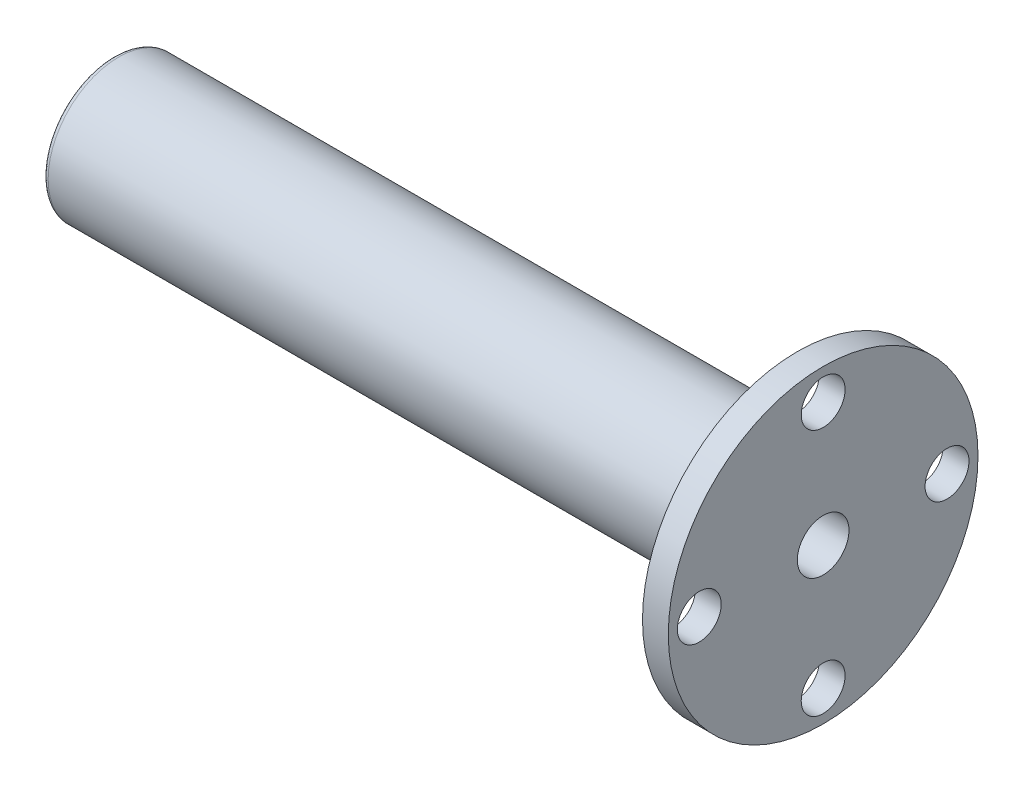
from build123d import *

# Parameters (mm, degrees)
ESQUISSE2_R                  = 8.5
ESQUISSE2_R_2                = 10
ENL_V_MAT_EXTRU_1_DEPTH      = 25
ESQUISSE3_R                  = 5
ENL_V_MAT_EXTRU_2_DEPTH      = 113.6
CONG_1_R                     = 2
ENL_V_MAT_EXTRU_3_DEPTH      = 5
ENL_V_MAT_EXTRU_3_DEPTH_BACK = 105.5
ESQUISSE4_R                  = 5


with BuildPart() as part:
    # Esquisse1 → Révolution1 (revolve)
    with BuildSketch(Plane.XY, mode=Mode.PRIVATE) as r_volution1_sk:
        Polygon((-75.054401386, 0), (199.945598614, 0), (199.945598614, 60), (189.945598614, 60), (189.945598614, 27.3), (-75.054401386, 27.3), align=None)
    revolve(r_volution1_sk.sketch.rotate(Axis((-75.054401386, 0, 0), (1, 0, 0)), 90), axis=Axis((-75.054401386, 0, 0), (1, 0, 0)))

    # Esquisse2 → Enlèv. mat.-Extru.1 (cut)
    with BuildSketch(Plane(origin=(199.945598614, 0, 0), x_dir=(0, 0, -1), z_dir=(1, 0, 0))):
        with Locations((0, 48)):
            Circle(ESQUISSE2_R)
        with Locations((0, -48)):
            Circle(ESQUISSE2_R)
        with Locations((-48, 0)):
            Circle(ESQUISSE2_R)
        with Locations((48, 0)):
            Circle(ESQUISSE2_R)
        Circle(ESQUISSE2_R_2)
    extrude(amount=-ENL_V_MAT_EXTRU_1_DEPTH, mode=Mode.SUBTRACT)

    # Esquisse3 → Enlèv. mat.-Extru.2 (cut)
    with BuildSketch(Plane(origin=(174.945598614, 0, 0), x_dir=(0, 0, -1), z_dir=(1, 0, 0))):
        Circle(ESQUISSE3_R)
    extrude(amount=-ENL_V_MAT_EXTRU_2_DEPTH, mode=Mode.SUBTRACT)

    # Congé1
    cong_1_edges = [part.edges().sort_by_distance(p)[0] for p in [
        (-75.054401386, 0, -27.3),
    ]]
    fillet(cong_1_edges, radius=CONG_1_R)

    # Esquisse4 → Enlèv. mat.-Extru.3 (cut, two sides: drawn at the far end of the back side and taken through both)
    with BuildSketch(Plane(origin=(0, 0, 0), x_dir=(1, 0, 0), z_dir=(0, 1, 0)).offset(-ENL_V_MAT_EXTRU_3_DEPTH_BACK)):
        with Locations(Location((59.445598614, 0, 0), (0, 0, 90))):
            Circle(ESQUISSE4_R)
    extrude(amount=ENL_V_MAT_EXTRU_3_DEPTH + ENL_V_MAT_EXTRU_3_DEPTH_BACK, mode=Mode.SUBTRACT)


solid = part.part
